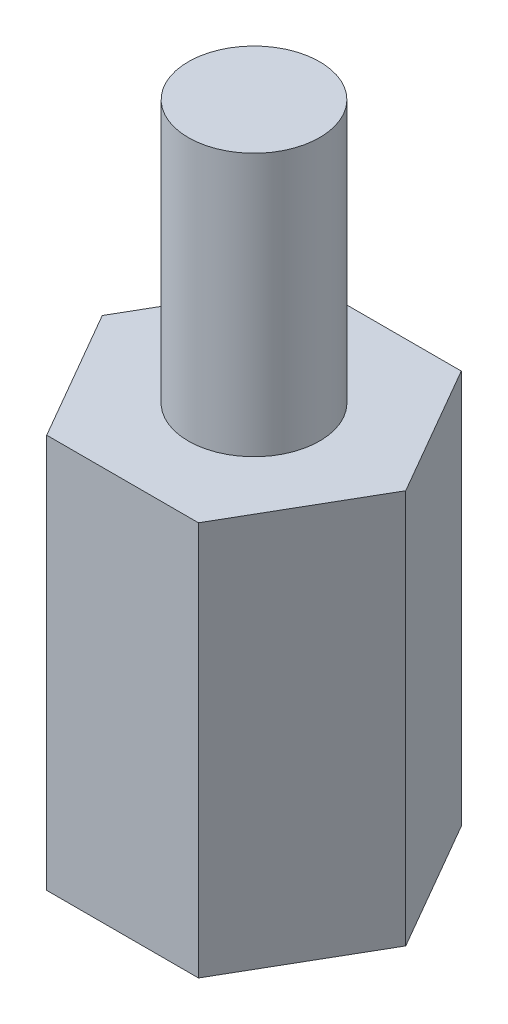
from build123d import *

# Parameters (mm, degrees)
EXTRUDE_1_DEPTH     = 6
SKETCH_2_R          = 1
EXTRUDE_2_DEPTH     = 4
SKETCH_3_R          = 1
CUT_EXTRUDE_1_DEPTH = 4


with BuildPart() as part:
    # 草图1 → 凸台-拉伸1 (new body)
    with BuildSketch(Plane(origin=(0, 0, 0), x_dir=(1, 0, 0), z_dir=(0, 1, 0))):
        Polygon((2.309401077, 0), (1.154700538, 2), (-1.154700538, 2), (-2.309401077, 0), (-1.154700538, -2), (1.154700538, -2), align=None)
    extrude(amount=EXTRUDE_1_DEPTH)

    # 草图2 → 凸台-拉伸2 (add)
    with BuildSketch(Plane(origin=(0, 6, 0), x_dir=(1, 0, 0), z_dir=(0, 1, 0))):
        with Locations(Location((0, 0, 0), (0, 0, 270))):
            Circle(SKETCH_2_R)
    extrude(amount=EXTRUDE_2_DEPTH)

    # 草图3 → 切除-拉伸1 (cut)
    with BuildSketch(Plane.XZ):
        with Locations(Location((0, 0, 0), (0, 0, 90))):
            Circle(SKETCH_3_R)
    extrude(amount=-CUT_EXTRUDE_1_DEPTH, mode=Mode.SUBTRACT)


solid = part.part
